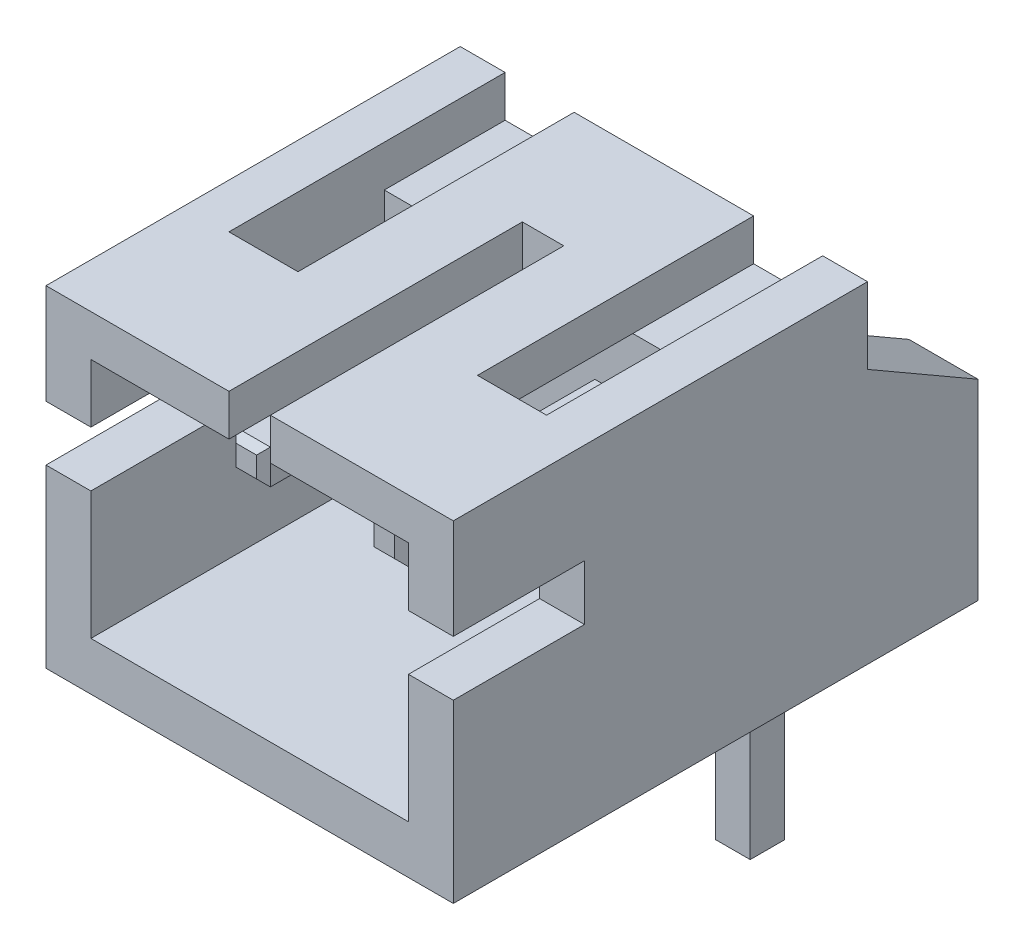
from build123d import *

# Parameters (mm, degrees)
EXTRUDE_1_DEPTH     = 0.6
EXTRUDE_2_DEPTH     = 3.5
SKETCH_3_W          = 5.9
SKETCH_3_H          = 6
EXTRUDE_3_DEPTH     = 0.7
EXTRUDE_4_REACH     = 15.883
SKETCH_4_W          = 0.5
SKETCH_4_H          = 2.85
SKETCH_5_W          = 0.5
SKETCH_5_H          = 0.5
EXTRUDE_5_DEPTH     = 3.4
EXTRUDE_6_REACH     = 17.656
SKETCH_7_W          = 0.5
SKETCH_7_H          = 2.85
SKETCH_8_W          = 0.5
SKETCH_8_H          = 0.5
EXTRUDE_7_DEPTH     = 3.4
SKETCH_9_W          = 4.6
SKETCH_9_H          = 1.85
CUT_EXTRUDE_1_DEPTH = 0.6
CUT_EXTRUDE_2_REACH = 16.257
SKETCH_10_W         = 1.9
SKETCH_10_H         = 0.8
SKETCH_11_W         = 1.9
SKETCH_11_H         = 0.8
CUT_EXTRUDE_3_DEPTH = 15.257366517
SKETCH_12_W         = 1
SKETCH_12_H         = 3.7
EXTRUDE_8_DEPTH     = 1.6
SKETCH_13_W         = 1
SKETCH_13_H         = 3.7
EXTRUDE_9_DEPTH     = 1.6
SKETCH_14_W         = 0.5
SKETCH_14_H         = 0.5
EXTRUDE_10_DEPTH    = 3.3
SKETCH_15_W         = 0.5
SKETCH_15_H         = 0.5
EXTRUDE_11_DEPTH    = 3.3
DRAFT_1_ANGLE       = 45
DRAFT_2_ANGLE       = 30
FILLET_1_R          = 0.4
CHAMFER_1_SIZE      = 0.1


with BuildPart() as part:
    # 草图1 → 凸台-拉伸1 (new body)
    with BuildSketch(Plane.XZ.offset(1.8)):
        Polygon((-7.45, 8.95), (-7.45, 4.7), (-8.05, 4.7), (-8.05, 8.95), (-10.7, 8.95), (-10.7, 2.95), (-10.05, 2.95), (-10.05, 6.95), (-9.05, 6.95), (-9.05, 2.95), (-6.45, 2.95), (-6.45, 6.95), (-5.45, 6.95), (-5.45, 2.95), (-4.8, 2.95), (-4.8, 8.95), align=None)
    extrude(amount=-EXTRUDE_1_DEPTH)

    # 草图2 → 凸台-拉伸2 (add)
    with BuildSketch(Plane.XZ.offset(1.8)):
        Polygon((-10.7, 8.95), (-10.05, 8.95), (-10.05, 4.7), (-5.45, 4.7), (-5.45, 8.95), (-4.8, 8.95), (-4.8, 2.95), (-10.7, 2.95), align=None)
    extrude(amount=EXTRUDE_2_DEPTH)

    # 草图3 → 凸台-拉伸3 (add)
    with BuildSketch(Plane.XZ.offset(5.3)):
        with Locations((-7.75, 5.95)):
            Rectangle(SKETCH_3_W, SKETCH_3_H)
    extrude(amount=EXTRUDE_3_DEPTH)

    # 草图4 → 凸台-拉伸4 (add, up to next)
    with BuildSketch(Plane(origin=(0, 0, 2.45), x_dir=(-1, 0, 0), z_dir=(0, 0, -1)), mode=Mode.PRIVATE) as extrude_4_sk1:
        with Locations((8.75, -4.575)):
            Rectangle(SKETCH_4_W, SKETCH_4_H)
    extrude_4_tool1 = extrude(extrude_4_sk1.sketch, amount=-EXTRUDE_4_REACH, mode=Mode.PRIVATE) - part.part
    add(extrude_4_tool1.solids().sort_by_distance((-8.75, -4.575, 2.45))[0])

    # 草图5 → 凸台-拉伸5 (add)
    with BuildSketch(Plane.XZ.offset(6)):
        with Locations((-8.75, 2.7)):
            Rectangle(SKETCH_5_W, SKETCH_5_H)
    extrude(amount=EXTRUDE_5_DEPTH)

    # 草图7 → 凸台-拉伸6 (add, up to next)
    with BuildSketch(Plane(origin=(0, 0, 2.45), x_dir=(-1, 0, 0), z_dir=(0, 0, -1)), mode=Mode.PRIVATE) as extrude_6_sk1:
        with Locations((6.75, -4.575)):
            Rectangle(SKETCH_7_W, SKETCH_7_H)
    extrude_6_tool1 = extrude(extrude_6_sk1.sketch, amount=-EXTRUDE_6_REACH, mode=Mode.PRIVATE) - part.part
    add(extrude_6_tool1.solids().sort_by_distance((-6.75, -4.575, 2.45))[0])

    # 草图8 → 凸台-拉伸7 (add)
    with BuildSketch(Plane.XZ.offset(6)):
        with Locations((-6.75, 2.7)):
            Rectangle(SKETCH_8_W, SKETCH_8_H)
    extrude(amount=EXTRUDE_7_DEPTH)

    # 草图9 → 切除-拉伸1 (cut)
    with BuildSketch(Plane.XY.offset(4.7)):
        with Locations((-7.75, -4.375)):
            Rectangle(SKETCH_9_W, SKETCH_9_H)
    extrude(amount=-CUT_EXTRUDE_1_DEPTH, mode=Mode.SUBTRACT)

    # 草图10 → 切除-拉伸2 (cut, up to next)
    with BuildSketch(Plane.ZY.offset(10.7), mode=Mode.PRIVATE) as cut_extrude_2_sk1:
        with Locations((8, -3.05)):
            Rectangle(SKETCH_10_W, SKETCH_10_H)
    cut_extrude_2_tool1 = extrude(cut_extrude_2_sk1.sketch, amount=-CUT_EXTRUDE_2_REACH, mode=Mode.PRIVATE) & part.part
    add(cut_extrude_2_tool1.solids().sort_by_distance((-10.7, -3.05, 8))[0], mode=Mode.SUBTRACT)

    # 草图11 → 切除-拉伸3 (cut, through all)
    with BuildSketch(Plane(origin=(-4.8, 0, 0), x_dir=(0, 0, -1), z_dir=(1, 0, 0))):
        with Locations((-8, -3.05)):
            Rectangle(SKETCH_11_W, SKETCH_11_H)
    extrude(amount=-CUT_EXTRUDE_3_DEPTH, mode=Mode.SUBTRACT)

    # 草图12 → 凸台-拉伸8 (add)
    with BuildSketch(Plane(origin=(0, 0, 2.95), x_dir=(-1, 0, 0), z_dir=(0, 0, -1))):
        with Locations((10.2, -4.15)):
            Rectangle(SKETCH_12_W, SKETCH_12_H)
    extrude(amount=EXTRUDE_8_DEPTH)

    # 草图13 → 凸台-拉伸9 (add)
    with BuildSketch(Plane(origin=(0, 0, 2.95), x_dir=(-1, 0, 0), z_dir=(0, 0, -1))):
        with Locations((5.3, -4.15)):
            Rectangle(SKETCH_13_W, SKETCH_13_H)
    extrude(amount=EXTRUDE_9_DEPTH)

    # 草图14 → 凸台-拉伸10 (add)
    with BuildSketch(Plane.XY.offset(4.7)):
        with Locations((-6.75, -2.9)):
            Rectangle(SKETCH_14_W, SKETCH_14_H)
    extrude(amount=EXTRUDE_10_DEPTH)

    # 草图15 → 凸台-拉伸11 (add)
    with BuildSketch(Plane.XY.offset(4.7)):
        with Locations((-8.75, -2.9)):
            Rectangle(SKETCH_15_W, SKETCH_15_H)
    extrude(amount=EXTRUDE_11_DEPTH)

    # 拔模1
    draft_1_faces = [part.faces().sort_by_distance(p)[0] for p in [
        (-7.75, -3.45, 4.4),
    ]]
    draft(draft_1_faces, Plane(origin=(-7.45, -1.2, 4.7), x_dir=(0, 1, 0), z_dir=(0, 0, 1)), DRAFT_1_ANGLE)

    # 拔模2
    draft_2_faces = [part.faces().sort_by_distance(p)[0] for p in [
        (-5.3, -2.3, 2.15),
        (-10.2, -2.3, 2.15),
    ]]
    draft(draft_2_faces, Plane(origin=(-5.45, -1.2, 2.95), x_dir=(-1, 0, 0), z_dir=(0, 0, -1)), DRAFT_2_ANGLE)

    # 圆角1
    fillet_1_edges = [part.edges().sort_by_distance(p)[0] for p in [
        (-8.75, -3.15, 2.45),
        (-6.75, -3.15, 2.45),
    ]]
    fillet(fillet_1_edges, radius=FILLET_1_R)

    # 倒角1
    chamfer_1_edges = [part.edges().sort_by_distance(p)[0] for p in [
        (-6.75, -9.4, 2.95),
        (-6.5, -9.4, 2.7),
        (-6.75, -9.4, 2.45),
        (-7, -9.4, 2.7),
        (-8.75, -9.4, 2.95),
        (-8.5, -9.4, 2.7),
        (-8.75, -9.4, 2.45),
        (-9, -9.4, 2.7),
        (-6.75, -2.65, 8),
        (-6.5, -2.9, 8),
        (-6.75, -3.15, 8),
        (-7, -2.9, 8),
        (-8.75, -2.65, 8),
        (-8.5, -2.9, 8),
        (-8.75, -3.15, 8),
        (-9, -2.9, 8),
    ]]
    chamfer(chamfer_1_edges, length=CHAMFER_1_SIZE)


solid = part.part
